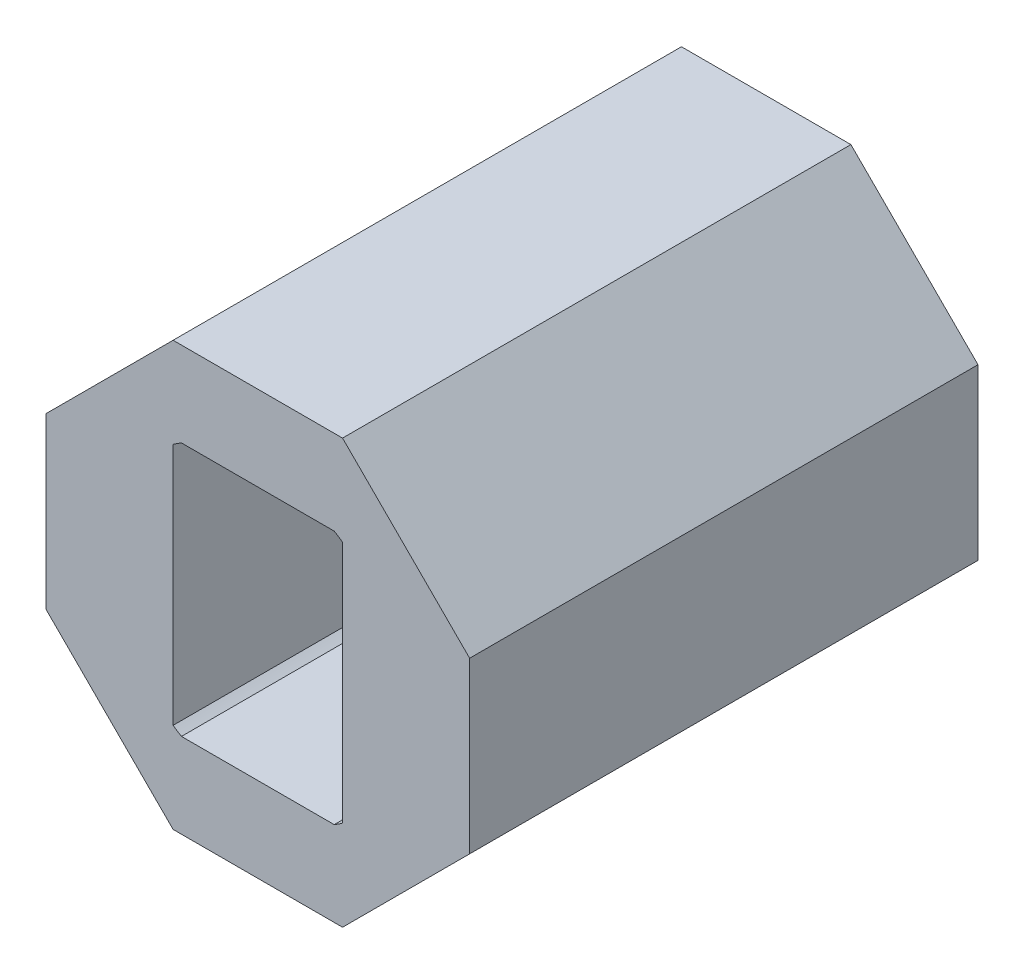
from build123d import *

# Parameters (mm, degrees)
SKETCH1_R           = 3.5
BOSS_EXTRUDE1_DEPTH = 12


with BuildPart() as part:
    # Sketch1 → Boss-Extrude1 (new body)
    # profile 1 of 5: a face of its own
    with BuildSketch(Plane(origin=(0, 0, 0), x_dir=(0, 1, 0), z_dir=(0, 0, 1))):
        Polygon((10, -3), (10, -7), (7, -10), (3, -10), (0, -7), (0, -3), (3, 0), (7, 0), align=None)
        with Locations((5, -5)):
            Circle(SKETCH1_R, mode=Mode.SUBTRACT)
    # profile 2 of 5: a face of its own
    with BuildSketch(Plane(origin=(0, 0, 0), x_dir=(0, 1, 0), z_dir=(0, 0, 1))):
        with BuildLine():
            ThreePointArc((7.872281323, -3), (5, -1.5), (2.127718677, -3))
            Line((2.127718677, -3), (7.872281323, -3))
        make_face()
    # profile 3 of 5: a face of its own
    with BuildSketch(Plane(origin=(0, 0, 0), x_dir=(0, 1, 0), z_dir=(0, 0, 1))):
        with BuildLine():
            Line((7.872281323, -7), (2.127718677, -7))
            ThreePointArc((2.127718677, -7), (5, -8.5), (7.872281323, -7))
        make_face()
    # profile 4 of 5: a face of its own
    with BuildSketch(Plane(origin=(0, 0, 0), x_dir=(0, 1, 0), z_dir=(0, 0, 1))):
        with BuildLine():
            Line((2, -6.802775638), (2, -3.197224362))
            ThreePointArc((2, -3.197224362), (1.5, -5), (2, -6.802775638))
        make_face()
    # profile 5 of 5: a face of its own
    with BuildSketch(Plane(origin=(0, 0, 0), x_dir=(0, 1, 0), z_dir=(0, 0, 1))):
        with BuildLine():
            ThreePointArc((8.5, -5), (8.372684391, -4.064585653), (8, -3.197224362))
            Line((8, -3.197224362), (8, -6.802775638))
            ThreePointArc((8, -6.802775638), (8.372684391, -5.935414347), (8.5, -5))
        make_face()
    extrude(amount=BOSS_EXTRUDE1_DEPTH)


solid = part.part
